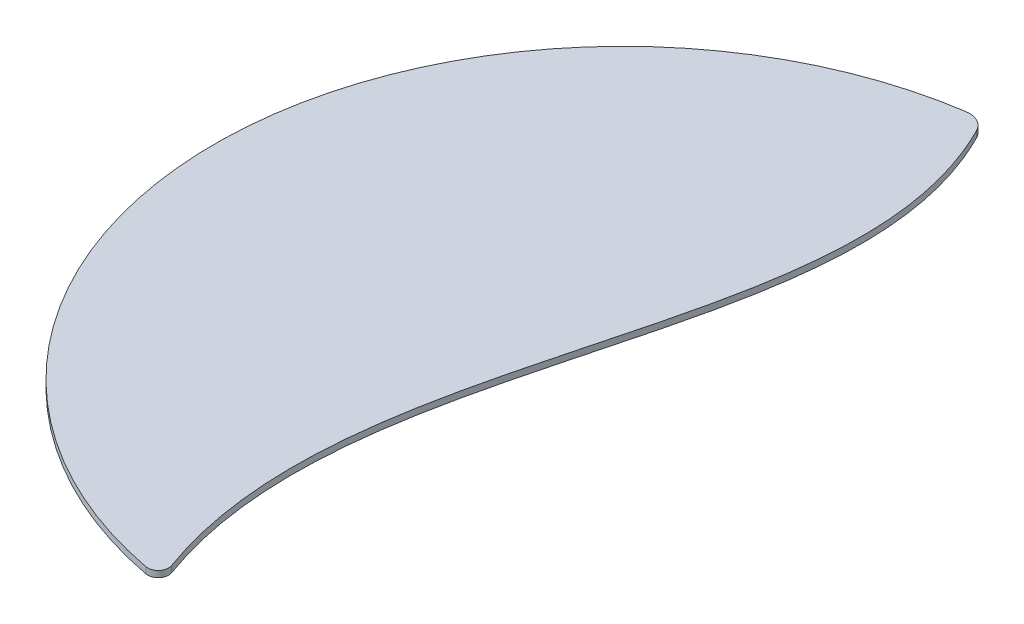
from build123d import *
from OCP.BRepFilletAPI import BRepFilletAPI_MakeFillet

# Parameters (mm, degrees)
BOSS_EXTRUDE5_DEPTH = 3
FILLET2_R1          = 5
FILLET2_R2          = 10


with BuildPart() as part:
    # Sketch1 → Boss-Extrude5 (new body)
    with BuildSketch(Plane(origin=(0, 0, 0), x_dir=(1, 0, 0), z_dir=(0, 1, 0))):
        with BuildLine():
            ThreePointArc((-21.711678963, 193.787520229), (-194.977343561, 2.97245654), (-27.608851206, -193.035621933))
            add(Edge.make_bspline(
                [(-21.711678963, 193.787520229), (-21.215906846, 192.901948597), (-20.236669685, 191.113640386), (-18.379248477, 187.563874928), (-16.218663363, 183.132088605), (-13.880363657, 177.832066934), (-11.083841534, 170.778461006), (-8.165911644, 161.976754005), (-5.51154676, 151.398455895), (-3.638350282, 140.766353814), (-2.103689887, 126.471919675), (-1.863050975, 108.324397723), (-3.85787606, 85.983216789), (-7.720800614, 63.076728972), (-12.982733753, 39.640419651), (-19.131949706, 15.713910349), (-25.623362601, -8.680214771), (-31.885036107, -33.542996426), (-37.31713678, -58.898561138), (-41.284300413, -84.784262962), (-43.105618433, -111.227065061), (-42.226930504, -133.706350521), (-39.716648062, -151.885293025), (-36.843581357, -165.585407167), (-33.553612687, -177.034814152), (-30.356651443, -186.174483349), (-28.550731137, -190.768029803), (-27.608851206, -193.035621933)],
                knots=[-0.006955973, -0.006955973, -0.006955973, -0.006955973, 0.000601698, 0.00815937, 0.023274712, 0.038390055, 0.053505398, 0.083736084, 0.113966769, 0.144197455, 0.17442814, 0.234889511, 0.295350883, 0.355812254, 0.416273625, 0.476734996, 0.537196367, 0.597657738, 0.658119109, 0.71858048, 0.779041852, 0.839503223, 0.869733908, 0.899964594, 0.930195279, 0.945310622, 0.960425965, 0.960425965, 0.960425965, 0.960425965], degree=3))
        make_face()
    extrude(amount=BOSS_EXTRUDE5_DEPTH)

    # Fillet2: one fillet with a radius per group of edges: ONE call of the kernel's fillet builder (fillet() takes one radius for all edges)
    fillet2_edges_1 = [part.edges().sort_by_distance(p)[0] for p in [
        (-27.608851206, 1.5, 193.035621933),
    ]]
    fillet2_edges_2 = [part.edges().sort_by_distance(p)[0] for p in [
        (-21.711678963, 1.5, -193.787520229),
    ]]
    fillet2 = BRepFilletAPI_MakeFillet(part.part.solid().wrapped)
    for e in fillet2_edges_1:
        fillet2.Add(FILLET2_R1, e.wrapped)
    for e in fillet2_edges_2:
        fillet2.Add(FILLET2_R2, e.wrapped)
    add(Compound.cast(fillet2.Shape()), mode=Mode.REPLACE)


solid = part.part
